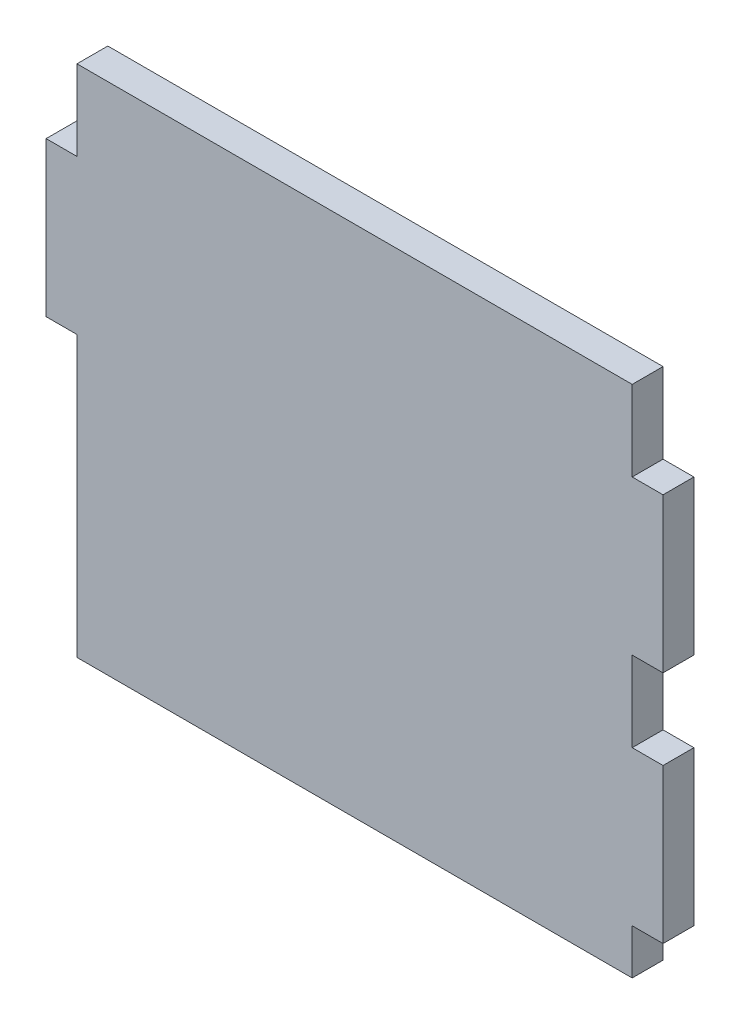
from build123d import *

# Parameters (mm, degrees)
SKETCH1_W           = 60
SKETCH1_H           = 50
BOSS_EXTRUDE1_DEPTH = 3
SKETCH2_W           = 3
SKETCH2_H           = 7.8
CUT_EXTRUDE1_DEPTH  = 53.999062732
LPATTERN1_COUNT     = 2
LPATTERN1_PITCH     = 22.8
SKETCH3_W           = 3
SKETCH3_H           = 7.8
CUT_EXTRUDE2_DEPTH  = 53.999062732
LPATTERN2_COUNT     = 4
LPATTERN2_PITCH     = 22.8
SKETCH6_W           = 3
SKETCH6_H           = 19.4
CUT_EXTRUDE3_DEPTH  = 10


with BuildPart() as part:
    # Sketch1 → Boss-Extrude1 (new body)
    with BuildSketch(Plane.XY):
        with Locations((-10.993460648, -8.457986111)):
            Rectangle(SKETCH1_W, SKETCH1_H)
    extrude(amount=BOSS_EXTRUDE1_DEPTH)

    # Sketch2 → Cut-Extrude1 (cut, through all)
    with BuildSketch(Plane.XY.offset(3)):
        with Locations((-39.493460648, 12.642013889)):
            Rectangle(SKETCH2_W, SKETCH2_H)
    cut_extrude1 = extrude(amount=-CUT_EXTRUDE1_DEPTH, mode=Mode.SUBTRACT)

    # LPattern1: Cut-Extrude1 ×2
    with Locations(*[(0, -i * LPATTERN1_PITCH, 0) for i in range(1, LPATTERN1_COUNT)]):
        add(cut_extrude1, mode=Mode.SUBTRACT)

    # Sketch3 → Cut-Extrude2 (cut, through all)
    with BuildSketch(Plane.XY.offset(3)):
        with Locations((17.506539352, 12.642013889)):
            Rectangle(SKETCH3_W, SKETCH3_H)
    cut_extrude2 = extrude(amount=-CUT_EXTRUDE2_DEPTH, mode=Mode.SUBTRACT)

    # LPattern2: Cut-Extrude2 ×4
    with Locations(*[(0, -i * LPATTERN2_PITCH, 0) for i in range(1, LPATTERN2_COUNT)]):
        add(cut_extrude2, mode=Mode.SUBTRACT)

    # Sketch6 → Cut-Extrude3 (cut)
    with BuildSketch(Plane.XY.offset(3)):
        with Locations((-39.493460648, -23.757986111)):
            Rectangle(SKETCH6_W, SKETCH6_H)
    extrude(amount=-CUT_EXTRUDE3_DEPTH, mode=Mode.SUBTRACT)


solid = part.part
